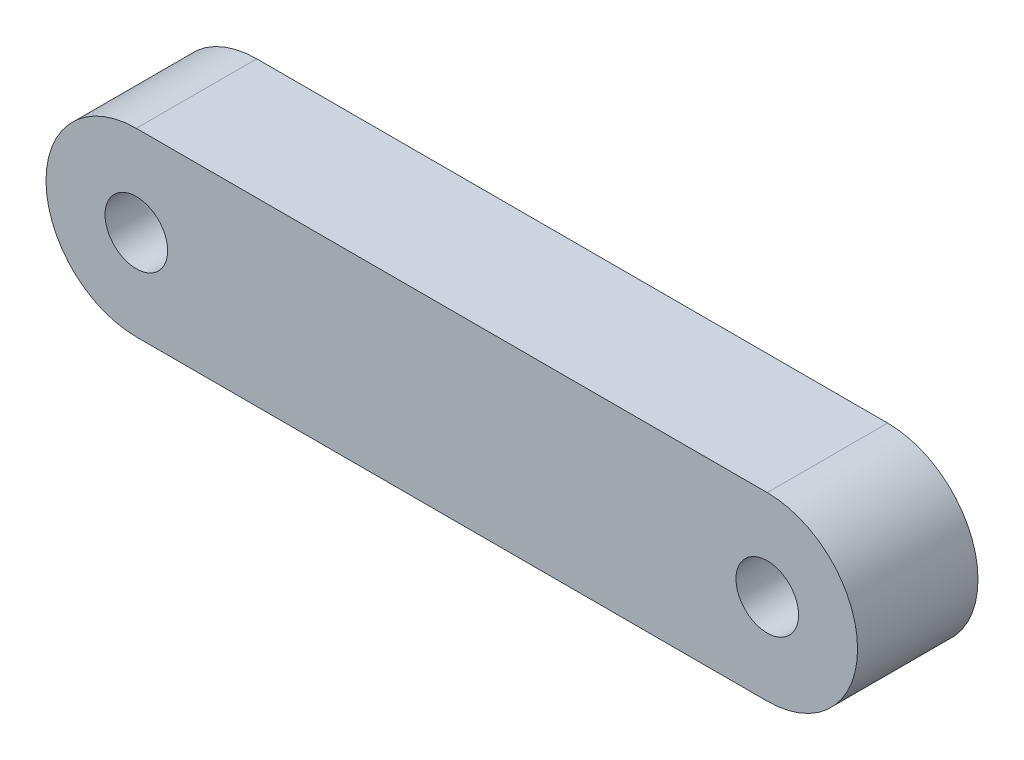
from build123d import *

# Parameters (mm, degrees)
SKETCH1_R           = 1.65
BOSS_EXTRUDE1_DEPTH = 6.35
CUT_EXTRUDE1_DEPTH  = 2.1
FILLET1_R           = 0.254


with BuildPart() as part:
    # Sketch1 → Boss-Extrude1 (new body)
    with BuildSketch(Plane.XY):
        with BuildLine():
            Line((-16.632351927, 4.7625), (16.632351927, 4.7625))
            ThreePointArc((16.632351927, 4.7625), (21.394851927, 0), (16.632351927, -4.7625))
            Line((16.632351927, -4.7625), (-16.632351927, -4.7625))
            ThreePointArc((-16.632351927, -4.7625), (-21.394851927, 0), (-16.632351927, 4.7625))
        make_face()
        with Locations((16.632351927, 0)):
            Circle(SKETCH1_R, mode=Mode.SUBTRACT)
        with Locations((-16.632351927, 0)):
            Circle(SKETCH1_R, mode=Mode.SUBTRACT)
    extrude(amount=BOSS_EXTRUDE1_DEPTH)

    # Sketch2 → Cut-Extrude1 (cut)
    with BuildSketch(Plane(origin=(0, 0, 0), x_dir=(-1, 0, 0), z_dir=(0, 0, -1))):
        Polygon((12.672553952, 0), (16.632351927, -3.959797975), (20.592149902, 0), (16.632351927, 3.959797975), align=None)
    extrude(amount=-CUT_EXTRUDE1_DEPTH, mode=Mode.SUBTRACT)

    # Fillet1
    fillet1_edges = [part.edges().sort_by_distance(p)[0] for p in [
        (-20.592149902, 0, 1.05),
        (-16.632351927, -3.959797975, 1.05),
        (-12.672553952, 0, 1.05),
        (-16.632351927, 3.959797975, 1.05),
    ]]
    fillet(fillet1_edges, radius=FILLET1_R)


solid = part.part
